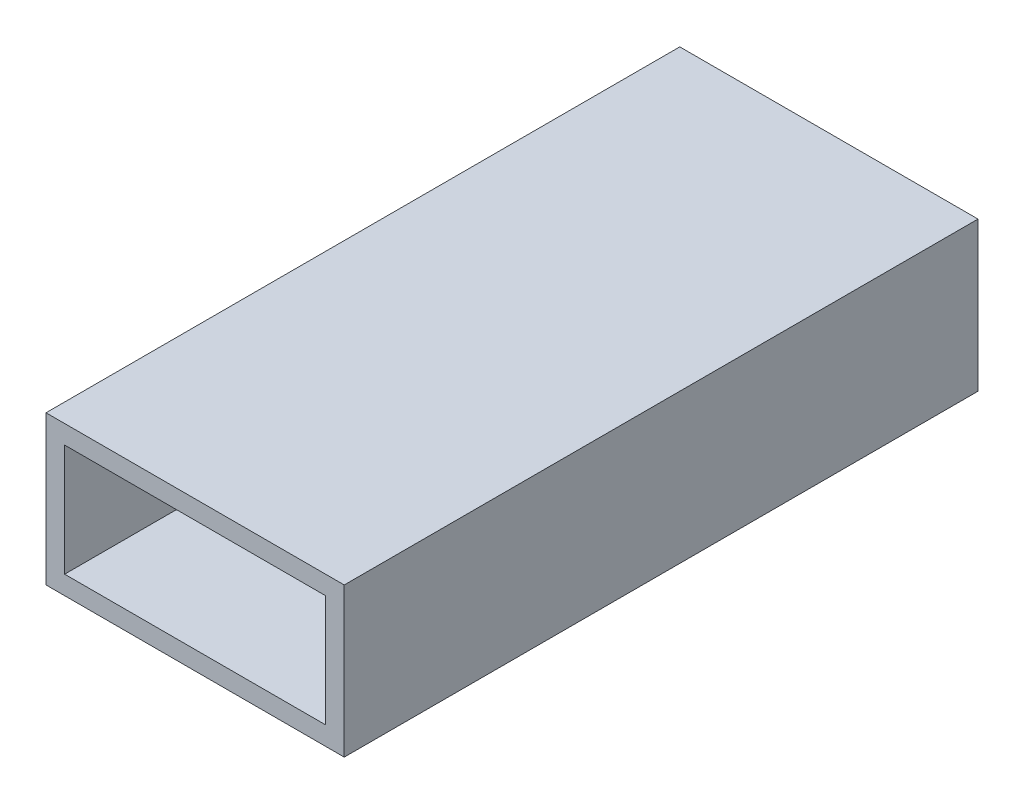
from build123d import *

# Parameters (mm, degrees)
SKETCH1_W           = 50.8
SKETCH1_H           = 25.4
BOSS_EXTRUDE1_DEPTH = 107.95
SKETCH2_W           = 44.45
SKETCH2_H           = 19.05
CUT_EXTRUDE1_DEPTH  = 1147.965228012


with BuildPart() as part:
    # Sketch1 → Boss-Extrude1 (new body)
    with BuildSketch(Plane.XY):
        with Locations((-965.320655189, 555.057532007)):
            Rectangle(SKETCH1_W, SKETCH1_H)
    extrude(amount=BOSS_EXTRUDE1_DEPTH)

    # Sketch2 → Cut-Extrude1 (cut, through all)
    with BuildSketch(Plane.XY.offset(107.95)):
        with Locations((-965.320655189, 555.057532007)):
            Rectangle(SKETCH2_W, SKETCH2_H)
    extrude(amount=-CUT_EXTRUDE1_DEPTH, mode=Mode.SUBTRACT)


solid = part.part
